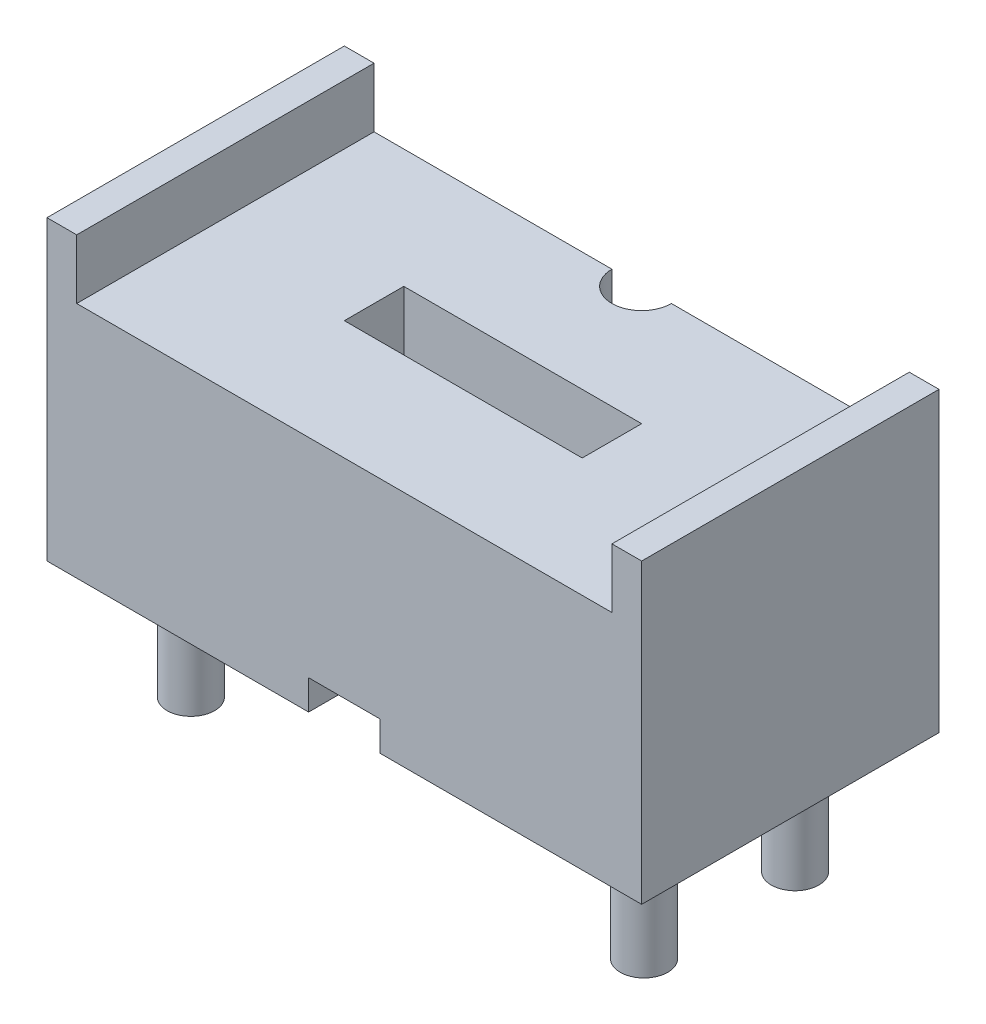
from build123d import *

# Parameters (mm, degrees)
SKETCH_1_W          = 10
SKETCH_1_H          = 5
EXTRUDE_1_DEPTH     = 5
CUT_EXTRUDE_1_REACH = 14.247
SKETCH_2_R          = 0.5
CUT_EXTRUDE_2_REACH = 14.247
SKETCH_4_W          = 4.5
SKETCH_4_H          = 1
SKETCH_4_W_2        = 0.6
SKETCH_4_H_2        = 0.5
CUT_EXTRUDE_3_REACH = 13.874
SKETCH_5_W          = 4
SKETCH_5_H          = 1
SKETCH_6_R          = 0.4
EXTRUDE_2_DEPTH     = 2


with BuildPart() as part:
    # 草图1 → 凸台-拉伸1 (new body)
    with BuildSketch(Plane(origin=(0, 0, 0), x_dir=(1, 0, 0), z_dir=(0, 1, 0))):
        with Locations((5, 2.5)):
            Rectangle(SKETCH_1_W, SKETCH_1_H)
    extrude(amount=EXTRUDE_1_DEPTH)

    # 草图2 → 切除-拉伸1 (cut, up to next)
    with BuildSketch(Plane(origin=(0, 5, 0), x_dir=(-1, 0, 0), z_dir=(0, 1, 0)), mode=Mode.PRIVATE) as cut_extrude_1_sk1:
        with Locations((-5, -5)):
            Circle(SKETCH_2_R)
    cut_extrude_1_tool1 = extrude(cut_extrude_1_sk1.sketch, amount=-CUT_EXTRUDE_1_REACH, mode=Mode.PRIVATE) & part.part
    add(cut_extrude_1_tool1.solids().sort_by_distance((5, 5, -5))[0], mode=Mode.SUBTRACT)

    # 草图4 → 切除-拉伸2 (cut, up to next)
    with BuildSketch(Plane.XY, mode=Mode.PRIVATE) as cut_extrude_2_sk1:
        with Locations((2.75, 4.5)):
            Rectangle(SKETCH_4_W, SKETCH_4_H)
    cut_extrude_2_tool1 = extrude(cut_extrude_2_sk1.sketch, amount=-CUT_EXTRUDE_2_REACH, mode=Mode.PRIVATE) & part.part
    # 草图4 → 切除-拉伸2 (cut, up to next)
    with BuildSketch(Plane.XY, mode=Mode.PRIVATE) as cut_extrude_2_sk2:
        with Locations((7.25, 4.5)):
            Rectangle(SKETCH_4_W, SKETCH_4_H)
    cut_extrude_2_tool2 = extrude(cut_extrude_2_sk2.sketch, amount=-CUT_EXTRUDE_2_REACH, mode=Mode.PRIVATE) & part.part
    # 草图4 → 切除-拉伸2 (cut, up to next)
    with BuildSketch(Plane.XY, mode=Mode.PRIVATE) as cut_extrude_2_sk3:
        with Locations((4.7, 0.25)):
            Rectangle(SKETCH_4_W_2, SKETCH_4_H_2)
    cut_extrude_2_tool3 = extrude(cut_extrude_2_sk3.sketch, amount=-CUT_EXTRUDE_2_REACH, mode=Mode.PRIVATE) & part.part
    # 草图4 → 切除-拉伸2 (cut, up to next)
    with BuildSketch(Plane.XY, mode=Mode.PRIVATE) as cut_extrude_2_sk4:
        with Locations((5.3, 0.25)):
            Rectangle(SKETCH_4_W_2, SKETCH_4_H_2)
    cut_extrude_2_tool4 = extrude(cut_extrude_2_sk4.sketch, amount=-CUT_EXTRUDE_2_REACH, mode=Mode.PRIVATE) & part.part
    add(cut_extrude_2_tool1.solids().sort_by_distance((2.75, 4.5, 0))[0], mode=Mode.SUBTRACT)
    add(cut_extrude_2_tool2.solids().sort_by_distance((7.25, 4.5, 0))[0], mode=Mode.SUBTRACT)
    add(cut_extrude_2_tool3.solids().sort_by_distance((4.7, 0.25, 0))[0], mode=Mode.SUBTRACT)
    add(cut_extrude_2_tool4.solids().sort_by_distance((5.3, 0.25, 0))[0], mode=Mode.SUBTRACT)

    # 草图5 → 切除-拉伸3 (cut, up to next)
    with BuildSketch(Plane(origin=(0, 4, 0), x_dir=(1, 0, 0), z_dir=(0, 1, 0)), mode=Mode.PRIVATE) as cut_extrude_3_sk1:
        with Locations((5, 2.5)):
            Rectangle(SKETCH_5_W, SKETCH_5_H)
    cut_extrude_3_tool1 = extrude(cut_extrude_3_sk1.sketch, amount=-CUT_EXTRUDE_3_REACH, mode=Mode.PRIVATE) & part.part
    add(cut_extrude_3_tool1.solids().sort_by_distance((5, 4, -2.5))[0], mode=Mode.SUBTRACT)

    # 草图6 → 凸台-拉伸2 (add)
    with BuildSketch(Plane.XZ):
        with Locations(Location((1.19, -1.23, 0), (0, 0, 90))):
            Circle(SKETCH_6_R)
        with Locations(Location((1.19, -3.77, 0), (0, 0, 90))):
            Circle(SKETCH_6_R)
        with Locations(Location((8.81, -3.77, 0), (0, 0, 90))):
            Circle(SKETCH_6_R)
        with Locations(Location((8.81, -1.23, 0), (0, 0, 90))):
            Circle(SKETCH_6_R)
    extrude(amount=EXTRUDE_2_DEPTH)


solid = part.part
